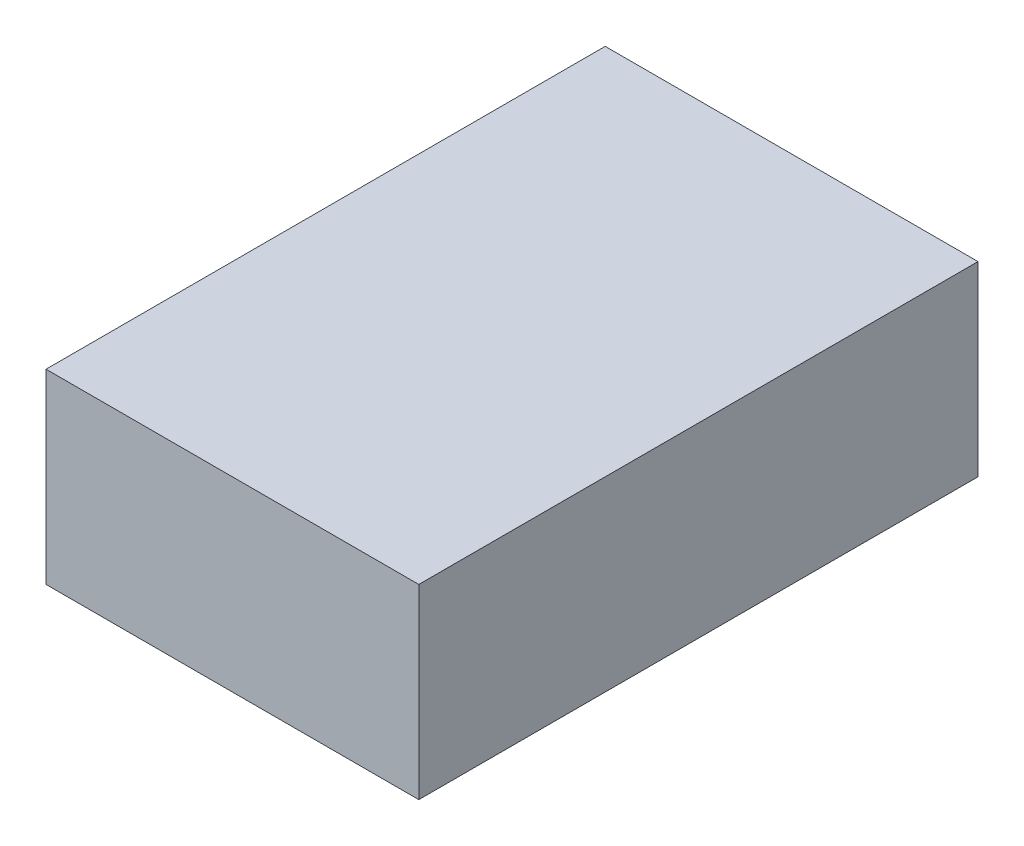
from build123d import *

# Parameters (mm, degrees)
SKETCH_1_W      = 20
SKETCH_1_H      = 30
EXTRUDE_1_DEPTH = 10


with BuildPart() as part:
    # 草图1 → 凸台-拉伸1 (new body)
    with BuildSketch(Plane(origin=(0, 0, 0), x_dir=(1, 0, 0), z_dir=(0, 1, 0))):
        with Locations((-6.15803634, -4.174115652)):
            Rectangle(SKETCH_1_W, SKETCH_1_H)
    extrude(amount=EXTRUDE_1_DEPTH)


solid = part.part
